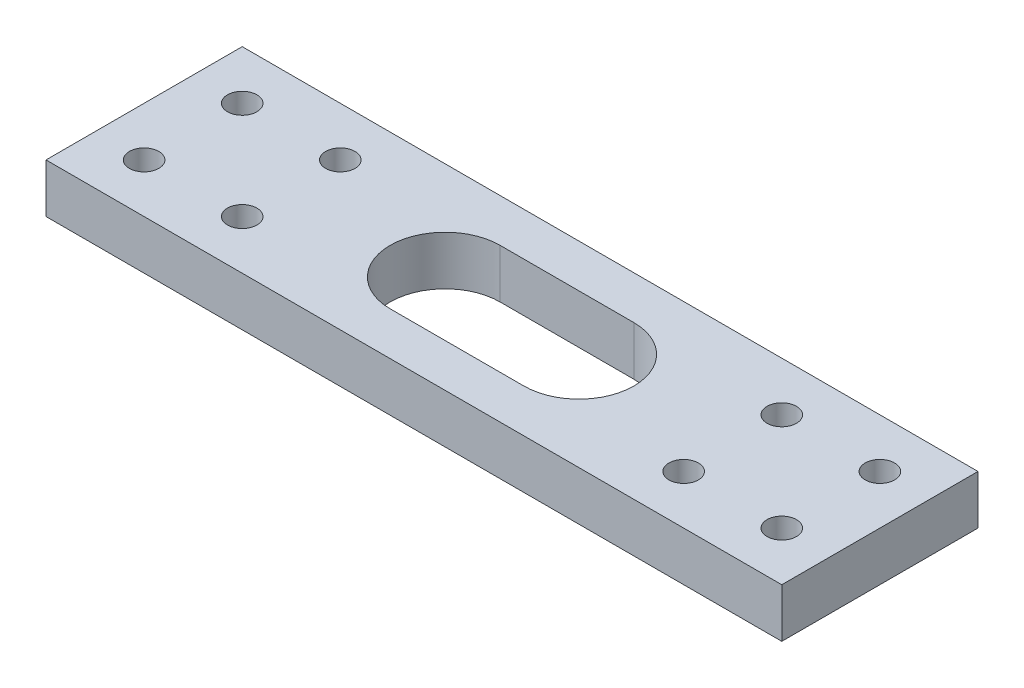
from build123d import *

# Parameters (mm, degrees)
SKETCH_1_W          = 75
SKETCH_1_H          = 20
EXTRUDE_1_DEPTH     = 5
SKETCH_2_R          = 1.5
CUT_EXTRUDE_1_DEPTH = 40.131189606
CUT_EXTRUDE_2_DEPTH = 40.131189606


with BuildPart() as part:
    # 草图1 → 凸台-拉伸1 (new body)
    with BuildSketch(Plane(origin=(0, 0, 0), x_dir=(1, 0, 0), z_dir=(0, 1, 0))):
        Rectangle(SKETCH_1_W, SKETCH_1_H)
    extrude(amount=EXTRUDE_1_DEPTH)

    # 草图2 → 切除-拉伸1 (cut, through all)
    with BuildSketch(Plane(origin=(0, 5, 0), x_dir=(1, 0, 0), z_dir=(0, 1, 0))):
        with Locations(Location((22.5, 5, 0), (0, 0, 270))):
            Circle(SKETCH_2_R)
        with Locations(Location((32.5, 5, 0), (0, 0, 270))):
            Circle(SKETCH_2_R)
        with Locations(Location((22.5, -5, 0), (0, 0, 270))):
            Circle(SKETCH_2_R)
        with Locations(Location((32.5, -5, 0), (0, 0, 270))):
            Circle(SKETCH_2_R)
    cut_extrude_1 = extrude(amount=-CUT_EXTRUDE_1_DEPTH, mode=Mode.SUBTRACT)

    # 草图3 → 切除-拉伸2 (cut, through all)
    with BuildSketch(Plane(origin=(0, 5, 0), x_dir=(1, 0, 0), z_dir=(0, 1, 0))):
        with BuildLine():
            Line((6.81829997, -5.602297427), (-6.81829997, -5.602297427))
            ThreePointArc((-6.81829997, -5.602297427), (-12.420597397, 0), (-6.81829997, 5.602297427))
            Line((-6.81829997, 5.602297427), (6.81829997, 5.602297427))
            ThreePointArc((6.81829997, 5.602297427), (12.420597397, 0), (6.81829997, -5.602297427))
        make_face()
    extrude(amount=-CUT_EXTRUDE_2_DEPTH, mode=Mode.SUBTRACT)

    # 镜向1: 切除-拉伸1 across plane
    add(cut_extrude_1.mirror(Plane(origin=(0, 0, 0), x_dir=(0, 0, 1), z_dir=(1, 0, 0))), mode=Mode.SUBTRACT)


solid = part.part
